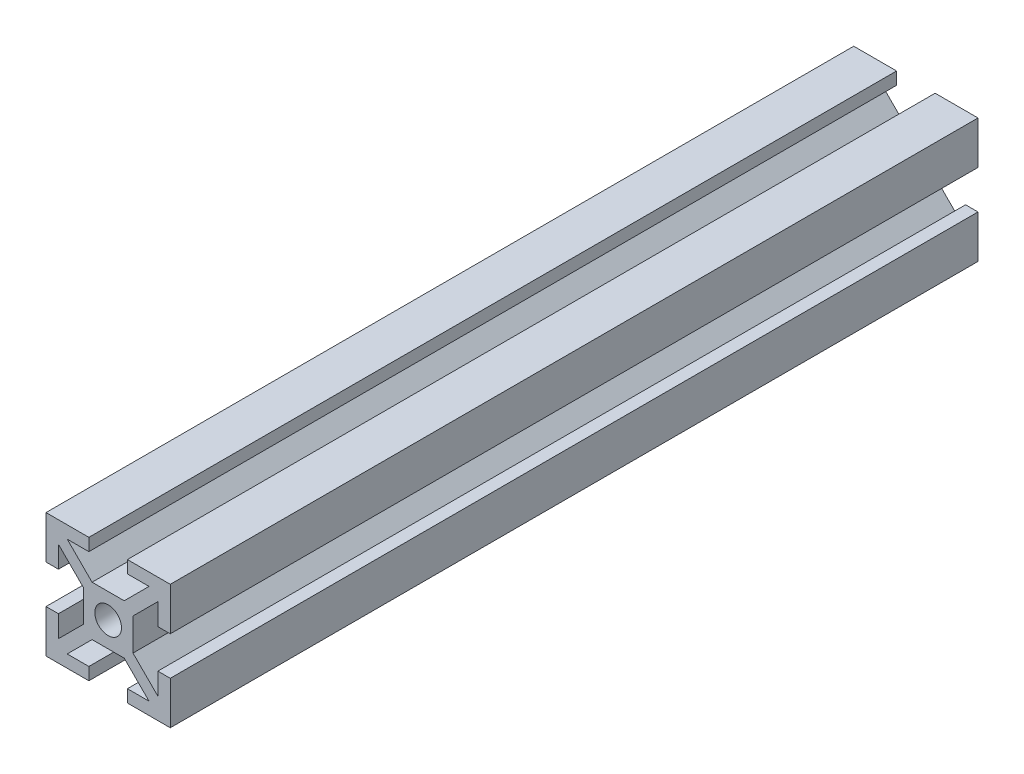
from build123d import *

# Parameters (mm, degrees)
ESQUISSE1_R        = 2.15
BOSS_EXTRU_1_DEPTH = 130


with BuildPart() as part:
    # Esquisse1 → Boss.-Extru.1 (new body)
    with BuildSketch(Plane.XY):
        Polygon((20, 13.1), (18, 13.1), (18, 16.585786438), (14, 12.585786438), (14, 10), (14, 7.414213562), (18, 3.414213562), (18, 6.9), (20, 6.9), (20, 0), (13.1, 0), (13.1, 2), (16.585786438, 2), (12.585786438, 6), (10, 6), (7.414213562, 6), (3.414213562, 2), (6.9, 2), (6.9, 0), (0, 0), (0, 6.9), (2, 6.9), (2, 3.414213562), (6, 7.414213562), (6, 10), (6, 12.585786438), (2, 16.585786438), (2, 13.1), (0, 13.1), (0, 20), (6.9, 20), (6.9, 18), (3.414213562, 18), (7.414213562, 14), (10, 14), (12.585786438, 14), (16.585786438, 18), (13.1, 18), (13.1, 20), (20, 20), align=None)
        with Locations((10, 10)):
            Circle(ESQUISSE1_R, mode=Mode.SUBTRACT)
    extrude(amount=BOSS_EXTRU_1_DEPTH)


solid = part.part
